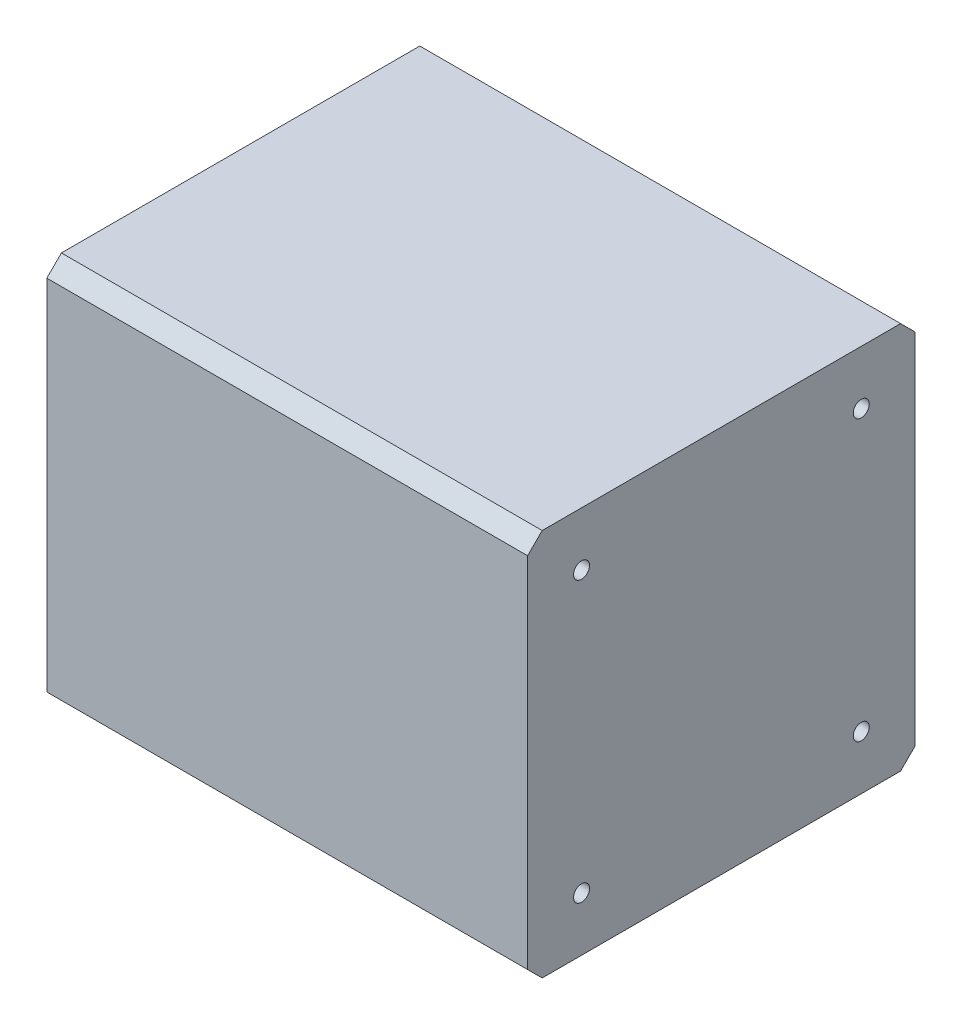
from build123d import *

# Parameters (mm, degrees)
SKETCH_1_W          = 133
SKETCH_1_H          = 133
SKETCH_1_W_2        = 122.5
SKETCH_1_H_2        = 122.5
EXTRUDE_1_DEPTH     = 160
SKETCH_2_W          = 133
SKETCH_2_H          = 133
EXTRUDE_2_DEPTH     = 5
CHAMFER_1_SIZE      = 5
SKETCH_3_R          = 2.75
CUT_EXTRUDE_1_DEPTH = 5
CUT_EXTRUDE_2_DEPTH = 10


with BuildPart() as part:
    # 草图1 → 凸台-拉伸1 (new body)
    with BuildSketch(Plane(origin=(0, 0, 0), x_dir=(0, 0, -1), z_dir=(1, 0, 0))):
        Rectangle(SKETCH_1_W, SKETCH_1_H)
        Rectangle(SKETCH_1_W_2, SKETCH_1_H_2, mode=Mode.SUBTRACT)
    extrude(amount=EXTRUDE_1_DEPTH)

    # 草图2 → 凸台-拉伸2 (add)
    with BuildSketch(Plane(origin=(160, 0, 0), x_dir=(0, 0, -1), z_dir=(1, 0, 0))):
        Rectangle(SKETCH_2_W, SKETCH_2_H)
    extrude(amount=EXTRUDE_2_DEPTH)

    # 倒角1
    chamfer_1_edges = [part.edges().sort_by_distance(p)[0] for p in [
        (82.5, 66.5, 66.5),
        (82.5, 66.5, -66.5),
        (82.5, -66.5, -66.5),
        (82.5, -66.5, 66.5),
    ]]
    chamfer(chamfer_1_edges, length=CHAMFER_1_SIZE)

    # 草图3 → 切除-拉伸1 (cut)
    with BuildSketch(Plane(origin=(165, 0, 0), x_dir=(0, 0, -1), z_dir=(1, 0, 0))):
        with Locations((48, 48)):
            Circle(SKETCH_3_R)
        with Locations((48, -48)):
            Circle(SKETCH_3_R)
        with Locations((-48, -48)):
            Circle(SKETCH_3_R)
        with Locations((-48, 48)):
            Circle(SKETCH_3_R)
    extrude(amount=-CUT_EXTRUDE_1_DEPTH, mode=Mode.SUBTRACT)

    # 草图4 → 切除-拉伸2 (cut)
    with BuildSketch(Plane.XZ.offset(66.5)):
        with BuildLine():
            Line((40, 20), (0, 20))
            Line((0, 20), (0, -20))
            Line((0, -20), (40, -20))
            ThreePointArc((40, -20), (60, 0), (40, 20))
        make_face()
    extrude(amount=-CUT_EXTRUDE_2_DEPTH, mode=Mode.SUBTRACT)


solid = part.part
